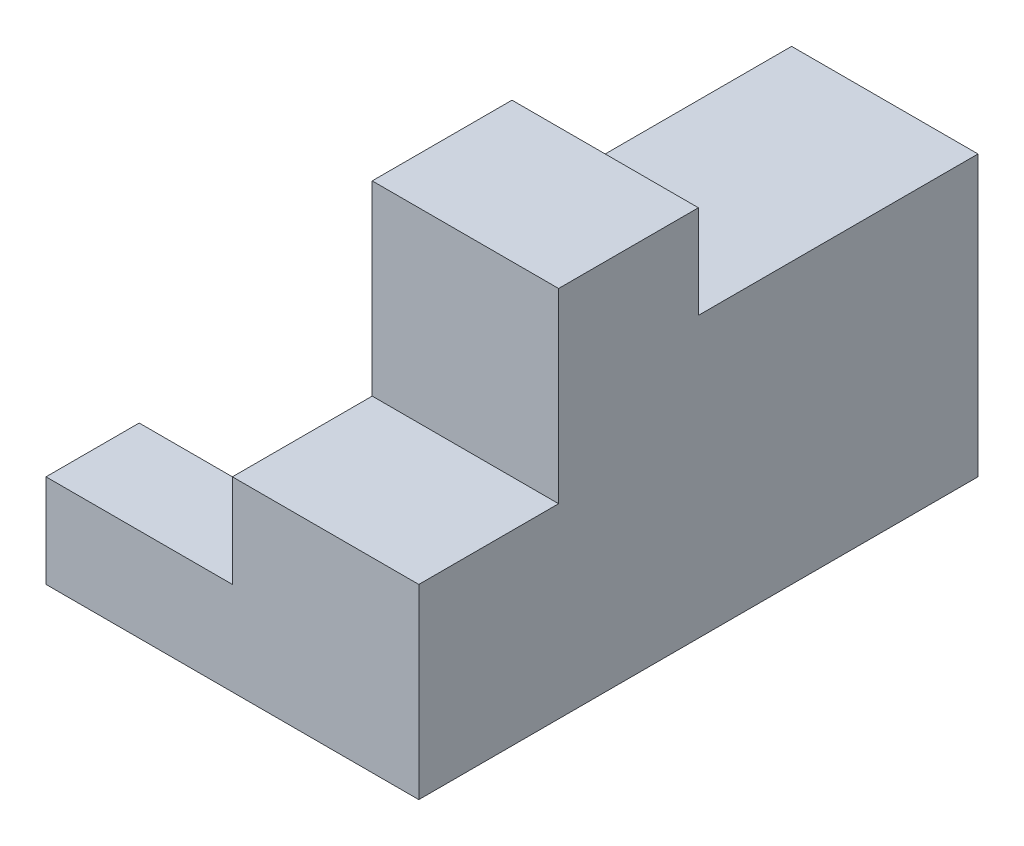
from build123d import *

# Parameters (mm, degrees)
SKETCH1_W           = 40
SKETCH1_H           = 40
BOSS_EXTRUDE1_DEPTH = 60
SKETCH3_W           = 10
SKETCH3_H           = 40
CUT_EXTRUDE1_DEPTH  = 60
CUT_EXTRUDE2_DEPTH  = 30
SKETCH5_W           = 10
SKETCH5_H           = 60
CUT_EXTRUDE3_DEPTH  = 30
SKETCH6_W           = 20
SKETCH6_H           = 30
CUT_EXTRUDE4_DEPTH  = 10
SKETCH7_W           = 20
SKETCH7_H           = 15
CUT_EXTRUDE5_DEPTH  = 20


with BuildPart() as part:
    # Sketch1 → Boss-Extrude1 (new body)
    with BuildSketch(Plane.XY):
        with Locations((20, 20)):
            Rectangle(SKETCH1_W, SKETCH1_H)
    extrude(amount=BOSS_EXTRUDE1_DEPTH)

    # Sketch3 → Cut-Extrude1 (cut)
    with BuildSketch(Plane(origin=(0, 40, 0), x_dir=(1, 0, 0), z_dir=(0, 1, 0))):
        with Locations((5, -30)):
            Rectangle(SKETCH3_W, SKETCH3_H)
    extrude(amount=-CUT_EXTRUDE1_DEPTH, mode=Mode.SUBTRACT)

    # Sketch4 → Cut-Extrude2 (cut)
    with BuildSketch(Plane(origin=(0, 40, 0), x_dir=(1, 0, 0), z_dir=(0, 1, 0))):
        Polygon((10, -10), (10, -60), (20, -60), (20, -10), (20, 0), (10, 0), align=None)
    extrude(amount=-CUT_EXTRUDE2_DEPTH, mode=Mode.SUBTRACT)

    # Sketch5 → Cut-Extrude3 (cut)
    with BuildSketch(Plane(origin=(0, 40, 0), x_dir=(1, 0, 0), z_dir=(0, 1, 0))):
        with Locations((5, -30)):
            Rectangle(SKETCH5_W, SKETCH5_H)
    extrude(amount=-CUT_EXTRUDE3_DEPTH, mode=Mode.SUBTRACT)

    # Sketch6 → Cut-Extrude4 (cut)
    with BuildSketch(Plane(origin=(0, 40, 0), x_dir=(1, 0, 0), z_dir=(0, 1, 0))):
        with Locations((30, -15)):
            Rectangle(SKETCH6_W, SKETCH6_H)
    extrude(amount=-CUT_EXTRUDE4_DEPTH, mode=Mode.SUBTRACT)

    # Sketch7 → Cut-Extrude5 (cut)
    with BuildSketch(Plane(origin=(0, 40, 0), x_dir=(1, 0, 0), z_dir=(0, 1, 0))):
        with Locations((30, -52.5)):
            Rectangle(SKETCH7_W, SKETCH7_H)
    extrude(amount=-CUT_EXTRUDE5_DEPTH, mode=Mode.SUBTRACT)


solid = part.part
